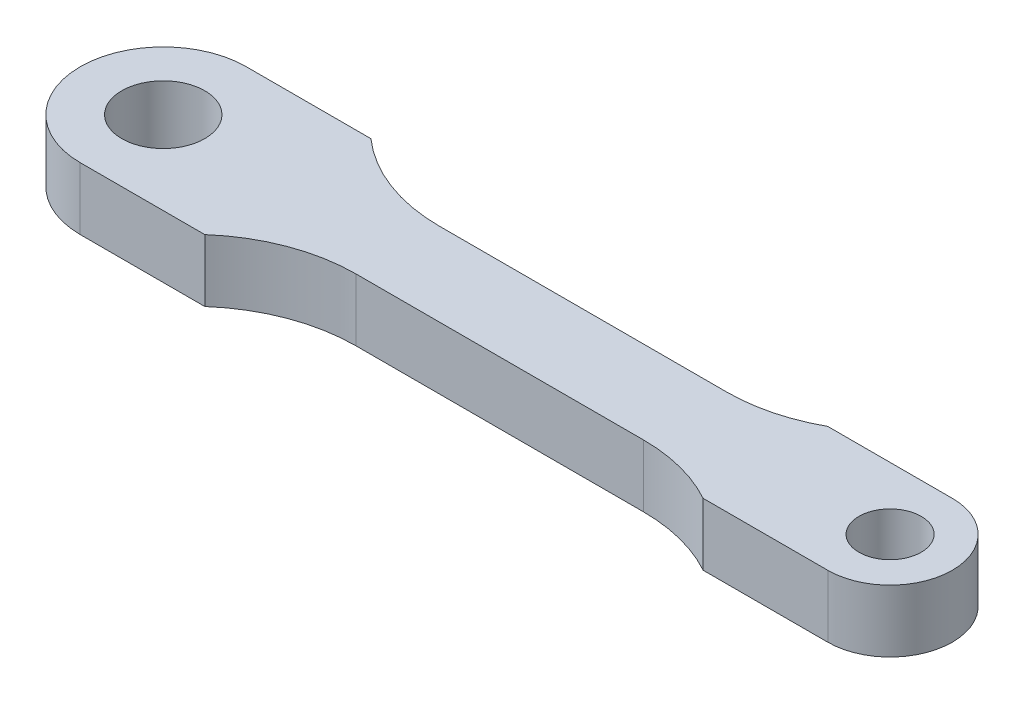
from build123d import *

# Parameters (mm, degrees)
SKETCH1_R           = 2
SKETCH1_R_2         = 1.5
BOSS_EXTRUDE1_DEPTH = 1.5
CUT_EXTRUDE1_DEPTH  = 3


with BuildPart() as part:
    # Sketch1 → Boss-Extrude1 (new, symmetric)
    with BuildSketch(Plane(origin=(0, 0, 0), x_dir=(1, 0, 0), z_dir=(0, 1, 0))):
        with BuildLine():
            Line((-17.5, 4), (-11.5, 4))
            Line((-11.5, 4), (11.5, 3))
            Line((11.5, 3), (17.5, 3))
            ThreePointArc((17.5, 3), (20.5, 0), (17.5, -3))
            Line((17.5, -3), (11.5, -3))
            Line((11.5, -3), (-11.5, -4))
            Line((-11.5, -4), (-17.5, -4))
            ThreePointArc((-17.5, -4), (-21.5, 0), (-17.5, 4))
        make_face()
        with Locations(Location((-17.5, 0, 0), (0, 0, 270))):
            Circle(SKETCH1_R, mode=Mode.SUBTRACT)
        with Locations(Location((17.5, 0, 0), (0, 0, 270))):
            Circle(SKETCH1_R_2, mode=Mode.SUBTRACT)
    extrude(amount=BOSS_EXTRUDE1_DEPTH, both=True)

    # Sketch2 → Cut-Extrude1 (cut)
    with BuildSketch(Plane(origin=(0, 1.5, 0), x_dir=(1, 0, 0), z_dir=(0, 1, 0))):
        with BuildLine():
            Line((-11.5, 4), (11.5, 3))
            ThreePointArc((11.5, 3), (9.627016654, 2.254033308), (7.627016654, 2))
            Line((7.627016654, 2), (-6.208497378, 2))
            ThreePointArc((-6.208497378, 2), (-9.036924503, 2.516685226), (-11.5, 4))
        make_face()
    cut_extrude1 = extrude(amount=-CUT_EXTRUDE1_DEPTH, mode=Mode.SUBTRACT)

    # Mirror1: Cut-Extrude1 across plane
    add(cut_extrude1.mirror(Plane.XY), mode=Mode.SUBTRACT)


solid = part.part
